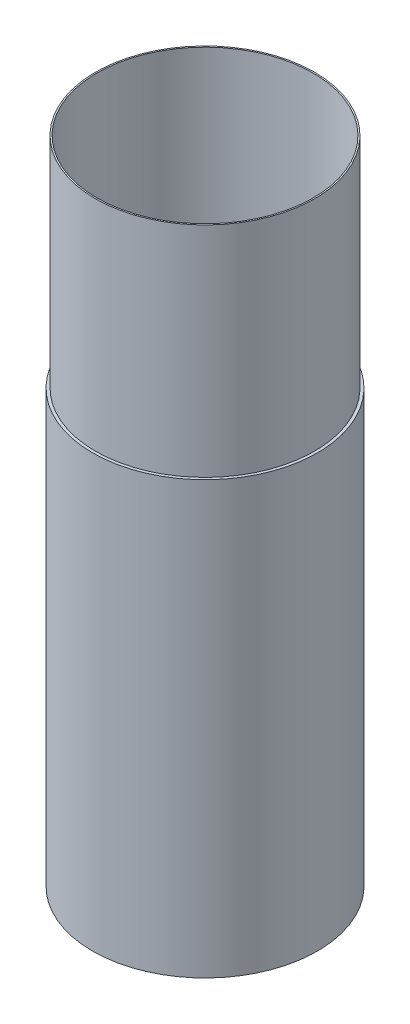
from build123d import *

# Parameters (mm, degrees)
SKETCH1_W                = 1.96
SKETCH1_H                = 300
BOSS_EXTRUDE1_DEPTH      = 152
BOSS_EXTRUDE1_DEPTH_BACK = 152
SKETCH3_R                = 76.2
SKETCH3_R_2              = 75.2


with BuildPart() as part:
    # Sketch1 → Revolve1 (revolve)
    with BuildSketch(Plane.XY, mode=Mode.PRIVATE) as revolve1_sk:
        with Locations((77.18, 150)):
            Rectangle(SKETCH1_W, SKETCH1_H)
    revolve(revolve1_sk.sketch.rotate(Axis((0, 204.615384615, 0), (0, -1, 0)), 90), axis=Axis((0, 204.615384615, 0), (0, -1, 0)))

    # Sketch3 → Boss-Extrude1 (add, two sides: drawn at the far end of the back side and taken through both)
    with BuildSketch(Plane(origin=(0, 300, 0), x_dir=(1, 0, 0), z_dir=(0, 1, 0)).offset(-BOSS_EXTRUDE1_DEPTH_BACK)):
        with Locations(Location((0, 0, 0), (0, 0, 270))):
            Circle(SKETCH3_R)
        with Locations(Location((0, 0, 0), (0, 0, 270))):
            Circle(SKETCH3_R_2, mode=Mode.SUBTRACT)
    extrude(amount=BOSS_EXTRUDE1_DEPTH + BOSS_EXTRUDE1_DEPTH_BACK)


solid = part.part
